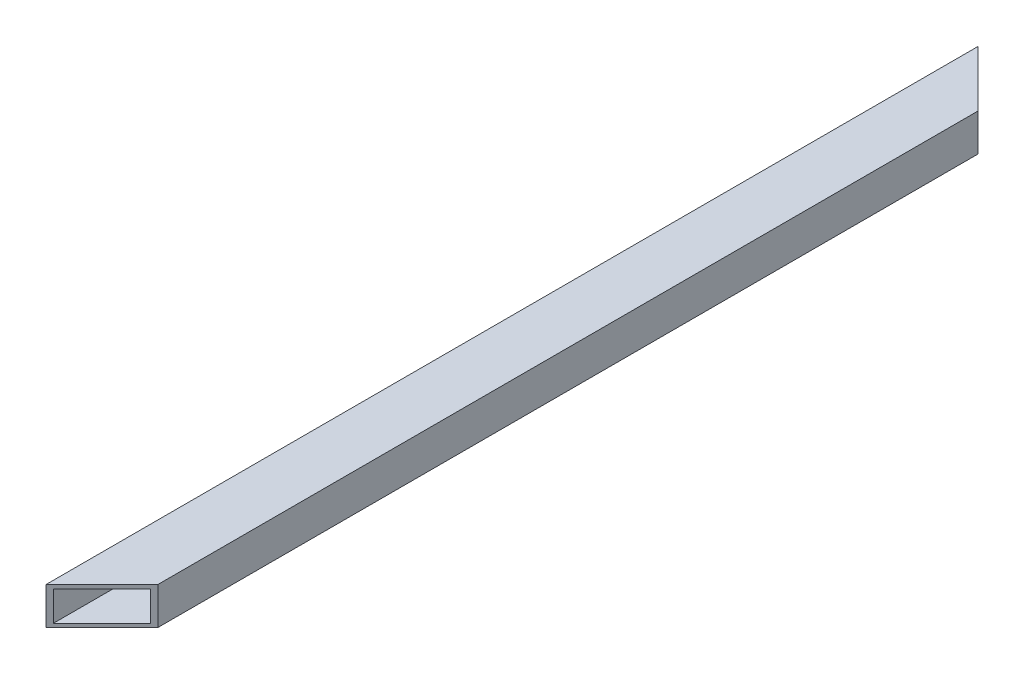
from build123d import *

# Parameters (mm, degrees)
SCHIZZO1_W                   = 30
SCHIZZO1_H                   = 20
SCHIZZO1_W_2                 = 26
SCHIZZO1_H_2                 = 16
ESTRUSIONE_ESTRUSIONE1_DEPTH = 500
TAGLIO_ESTRUSIONE1_DEPTH     = 501.624609863


with BuildPart() as part:
    # Schizzo1 → Estrusione-Estrusione1 (new body)
    with BuildSketch(Plane.XY):
        Rectangle(SCHIZZO1_W, SCHIZZO1_H)
        Rectangle(SCHIZZO1_W_2, SCHIZZO1_H_2, mode=Mode.SUBTRACT)
    extrude(amount=ESTRUSIONE_ESTRUSIONE1_DEPTH)

    # Schizzo2 → Taglio-Estrusione1 (cut, through all)
    with BuildSketch(Plane(origin=(0, 10, 0), x_dir=(1, 0, 0), z_dir=(0, 1, 0))):
        Polygon((-15, 0), (15, -30), (15, 0), align=None)
        Polygon((-15, -500), (15, -470), (15, -500), align=None)
    extrude(amount=-TAGLIO_ESTRUSIONE1_DEPTH, mode=Mode.SUBTRACT)


solid = part.part
